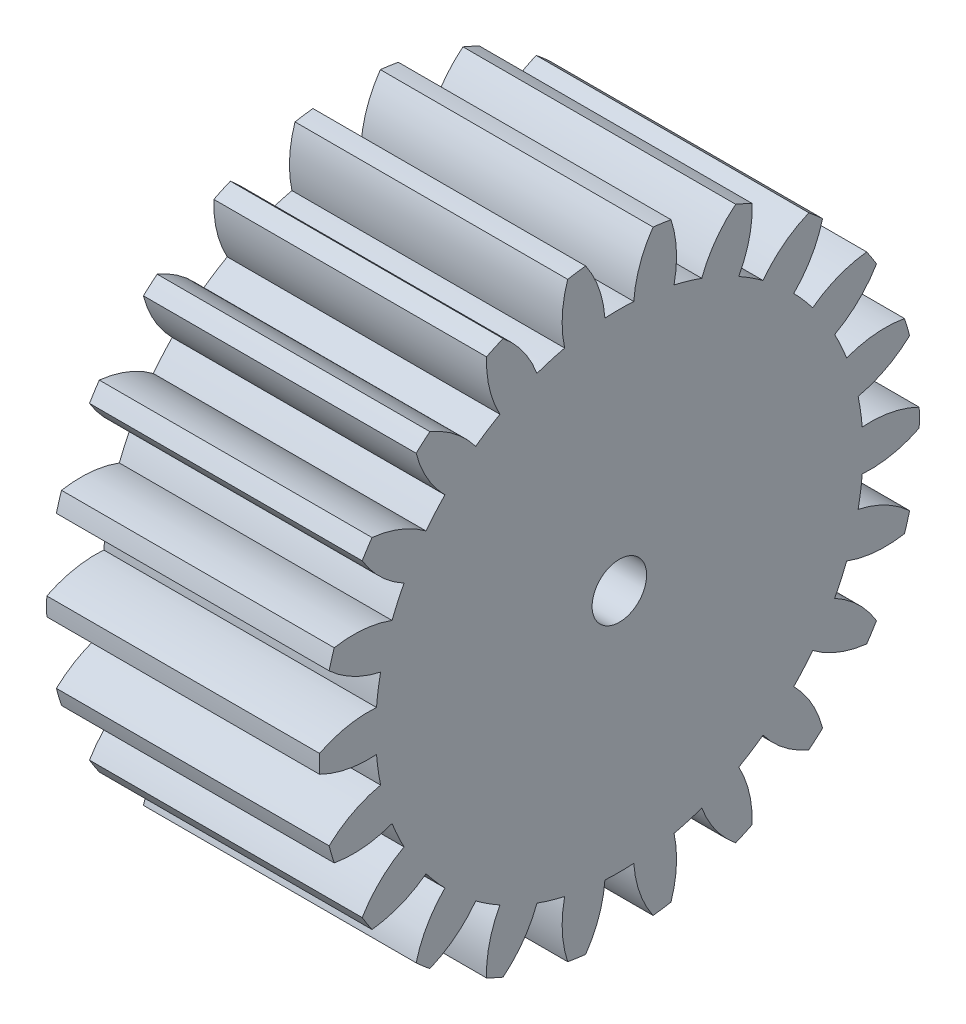
from build123d import *

# Parameters (mm, degrees)
BASPROSKE_W     = 15
BASPROSKE_H     = 16.5
TOOTHCUT_DEPTH  = 28.739863013
TEETHCUTS_COUNT = 22
BORSKE_R        = 1.5
BORE_DEPTH      = 50.0000508


with BuildPart() as part:
    # BasProSke → Base-Revolve (revolve)
    with BuildSketch(Plane(origin=(0, 0, 0), x_dir=(1, 0, 0), z_dir=(0, 1, 0)), mode=Mode.PRIVATE) as base_revolve_sk:
        with Locations((7.5, 8.25)):
            Rectangle(BASPROSKE_W, BASPROSKE_H)
    revolve(base_revolve_sk.sketch.rotate(Axis((-10, 0, 0), (1, 0, 0)), 180), axis=Axis((-10, 0, 0), (1, 0, 0)))

    # TooCutSke → ToothCut (cut, through all)
    with BuildSketch(Plane(origin=(0, 0, 0), x_dir=(0, 0, -1), z_dir=(1, 0, 0))):
        with BuildLine():
            ThreePointArc((0.79383235, 13.381724768), (0, 13.40525), (-0.79383235, 13.381724768))
            ThreePointArc((-0.79383235, 13.381724768), (-1.125821903, 14.973456057), (-1.869731633, 16.419285879))
            ThreePointArc((-1.869731633, 16.419285879), (0, 16.5254), (1.869731633, 16.419285879))
            ThreePointArc((1.869731633, 16.419285879), (1.125821903, 14.973456057), (0.79383235, 13.381724768))
        make_face()
    toothcut = extrude(amount=TOOTHCUT_DEPTH, mode=Mode.SUBTRACT)

    # TeethCuts: ToothCut ×22 about axis
    teethcuts_axis = Axis((0, 0, 0), (1, 0, 0))
    for i in range(1, TEETHCUTS_COUNT):
        add(toothcut.rotate(teethcuts_axis, i * 360 / TEETHCUTS_COUNT), mode=Mode.SUBTRACT)

    # BorSke → Bore (cut, symmetric)
    with BuildSketch(Plane(origin=(0, 0, 0), x_dir=(0, 0, -1), z_dir=(1, 0, 0))):
        with Locations(Location((0, 0, 0), (0, 0, 180))):
            Circle(BORSKE_R)
    extrude(amount=BORE_DEPTH, both=True, mode=Mode.SUBTRACT)


solid = part.part
